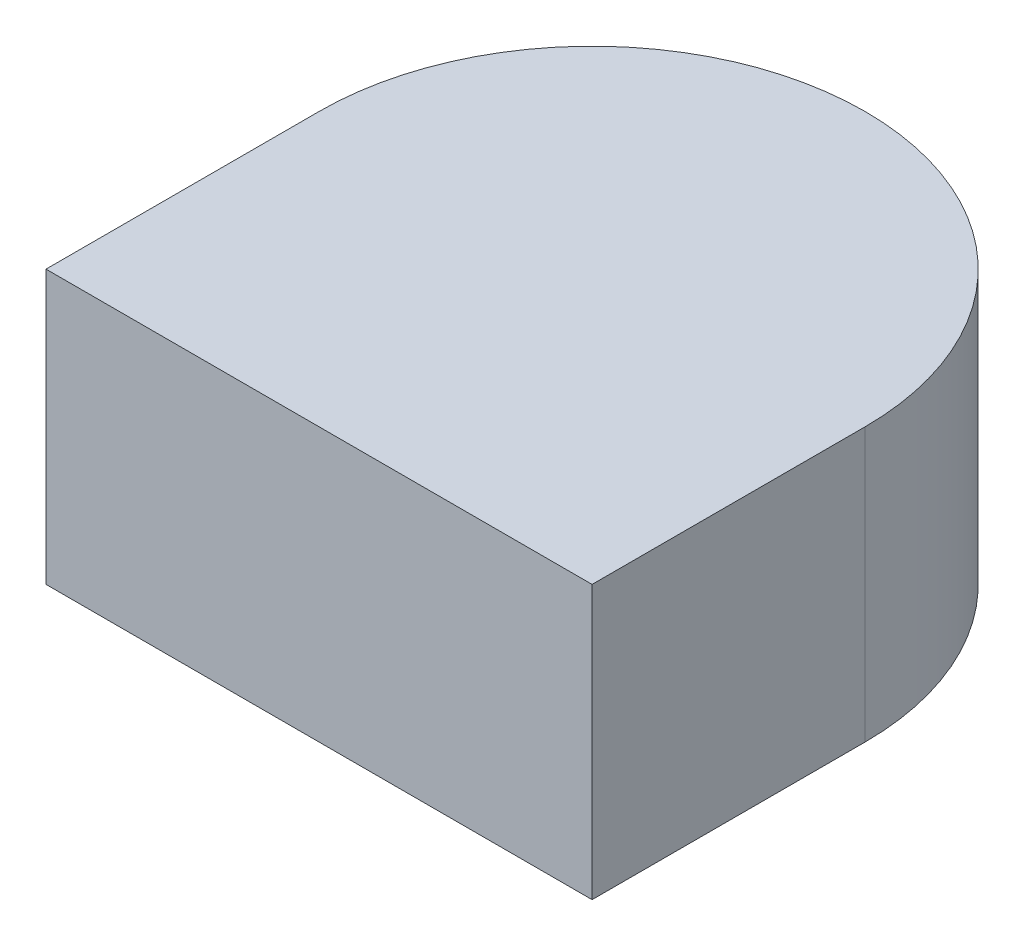
from build123d import *

# Parameters (mm, degrees)
BOSS_EXTRUDE1_DEPTH = 20


with BuildPart() as part:
    # Sketch1 → Boss-Extrude1 (new body)
    with BuildSketch(Plane(origin=(0, 0, 0), x_dir=(1, 0, 0), z_dir=(0, 1, 0))):
        with BuildLine():
            Line((-20, -40), (20, -40))
            Line((20, -40), (20, -20))
            ThreePointArc((20, -20), (0, 0), (-20, -20))
            Line((-20, -20), (-20, -40))
        make_face()
    extrude(amount=BOSS_EXTRUDE1_DEPTH)


solid = part.part
